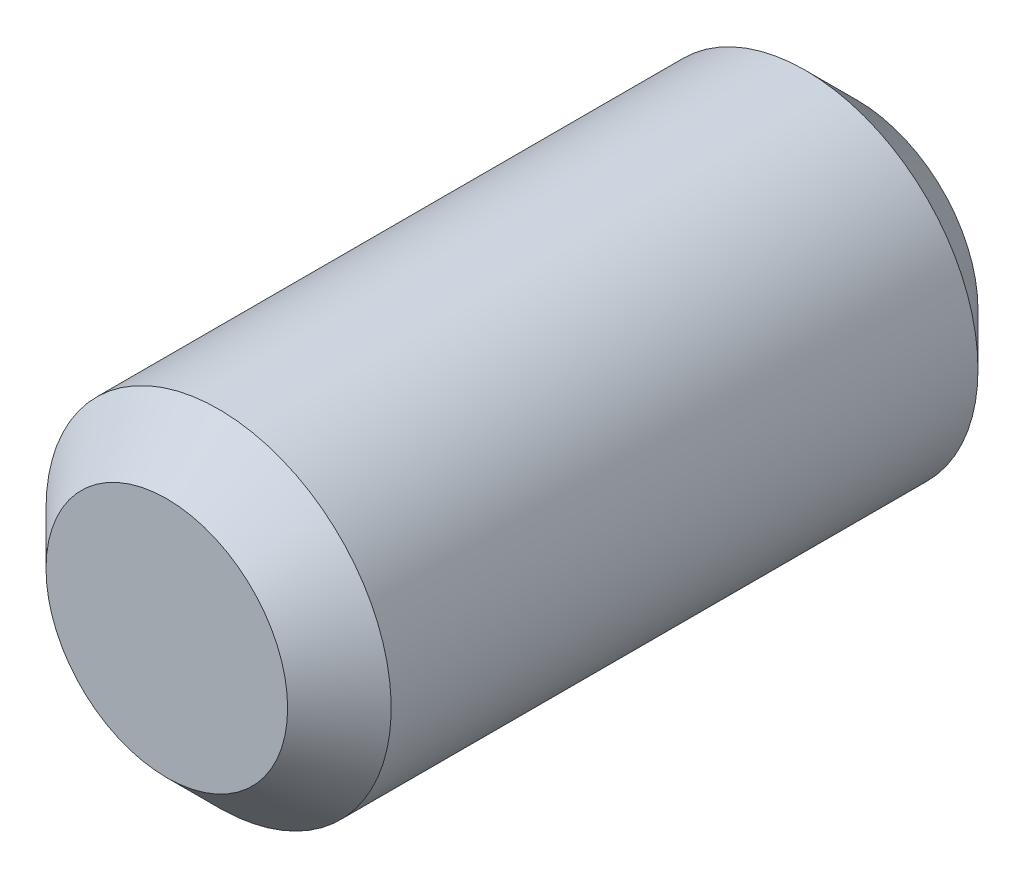
from build123d import *

# Parameters (mm, degrees)
SKETCH2_R           = 1
BOSS_EXTRUDE1_DEPTH = 4
CHAMFER1_SIZE       = 0.3


with BuildPart() as part:
    # Sketch2 → Boss-Extrude1 (new body)
    with BuildSketch(Plane.XY):
        Circle(SKETCH2_R)
    extrude(amount=BOSS_EXTRUDE1_DEPTH)

    # Chamfer1
    chamfer1_edges = [part.edges().sort_by_distance(p)[0] for p in [
        (-1, 0, 0),
        (-1, 0, 4),
    ]]
    chamfer(chamfer1_edges, length=CHAMFER1_SIZE)


solid = part.part
